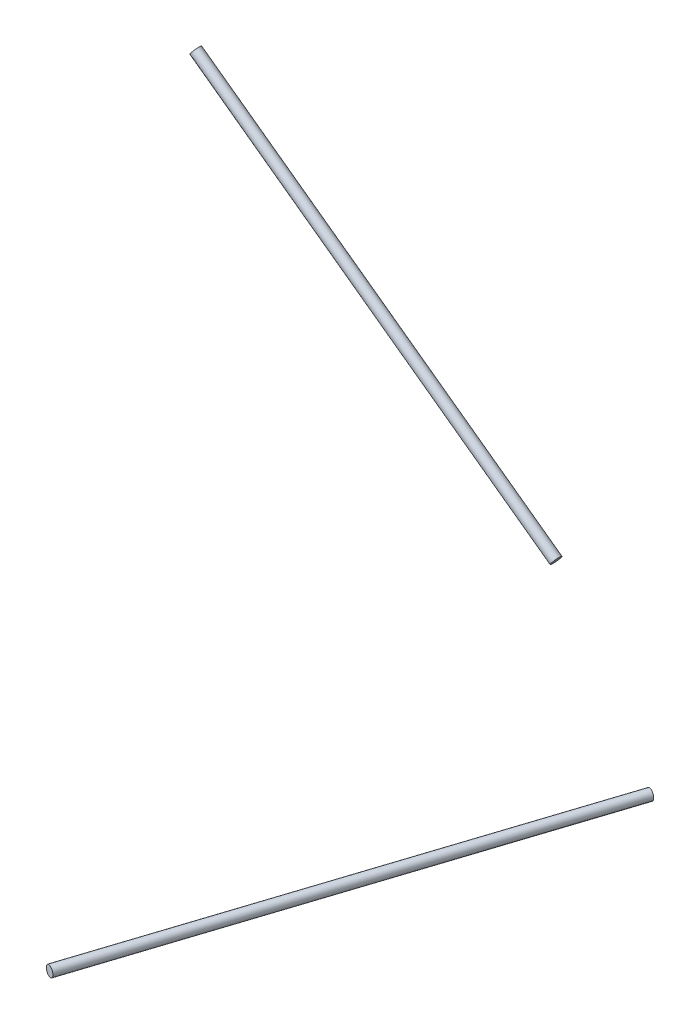
from build123d import *

# Parameters (mm, degrees)
SKETCH3_R = 1.5
SKETCH5_R = 1.5


with BuildPart() as part:
    # Sweep1: sweep along a path in Sketch2
    with BuildLine(Plane.XY) as sweep1_path:
        Line((178.792755757, 134.602822775), (72.764891712, 211.636575157))
    # Sketch3 → Sweep1 (sweep)
    with BuildSketch(Plane(origin=(72.764891712, 211.636575157, 0), x_dir=(0, 0, 1), z_dir=(-0.8090169943749471, 0.5877852522924736, 0))):
        Circle(SKETCH3_R)
    sweep(path=sweep1_path.line)


with BuildPart() as body_2:
    # Sweep2: sweep along a path in Sketch4
    with BuildLine(Plane(origin=(0, 0, 0), x_dir=(1, 0, 0), z_dir=(0, 1, 0))) as sweep2_path:
        Line((74.3249684, -44.590365223), (117.688753795, 88.869643197))
    # Sketch5 → Sweep2 (sweep)
    with BuildSketch(Plane(origin=(74.3249684, 0, 44.590365223), x_dir=(-0.9510565162951571, 0, -0.3090169943749368), z_dir=(0.3090169943749368, 0, -0.9510565162951571))):
        Circle(SKETCH5_R)
    sweep(path=sweep2_path.line)


solid = Compound([part.part, body_2.part])
